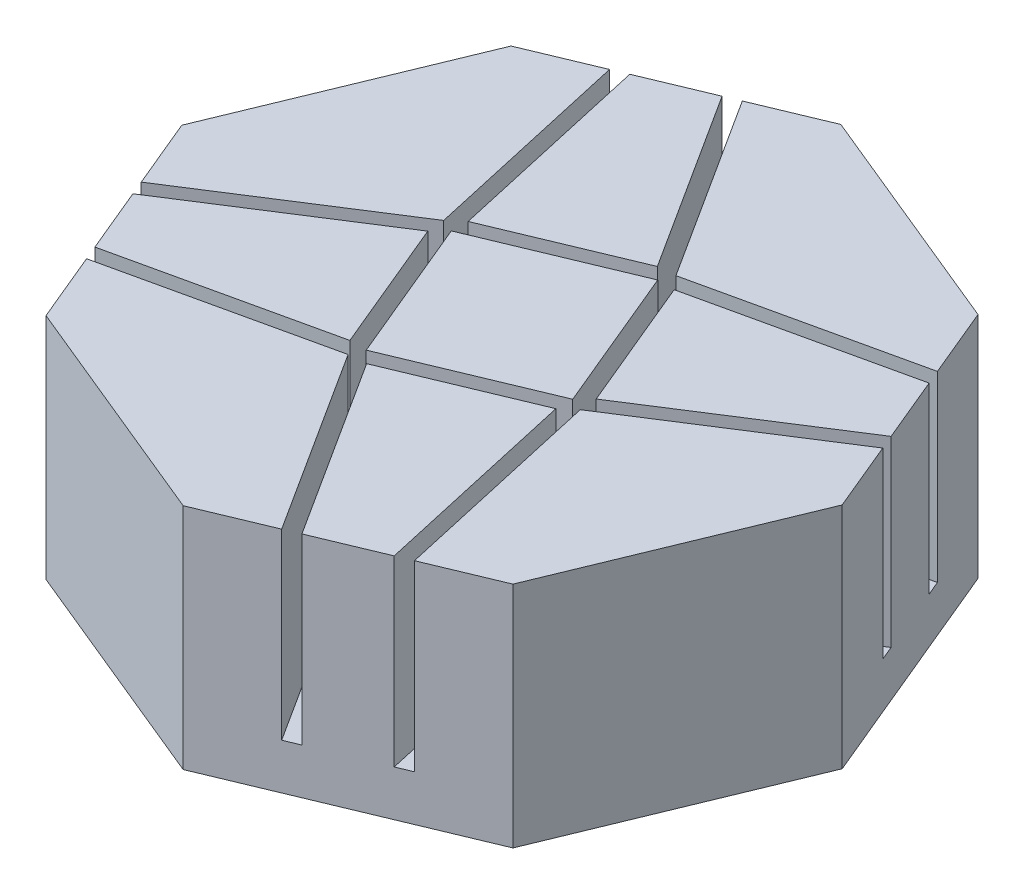
from build123d import *

# Parameters (mm, degrees)
BOSS_EXTRUDE1_DEPTH     = 38.1
CUT_EXTRUDE_THIN1_DEPTH = 30.48


with BuildPart() as part:
    # Sketch1 → Boss-Extrude1 (new body)
    with BuildSketch(Plane(origin=(0, 0, 0), x_dir=(1, 0, 0), z_dir=(0, 1, 0))):
        Polygon((-0.111992667, 54.937923296), (-38.926168882, 38.767787333), (-54.937923296, -0.111992667), (-38.767787333, -38.926168882), (0.111992667, -54.937923296), (38.926168882, -38.767787333), (54.937923296, 0.111992667), (38.767787333, 38.926168882), align=None)
    extrude(amount=BOSS_EXTRUDE1_DEPTH)

    # Sketch2 → Cut-Extrude-Thin1 (cut)
    with BuildSketch(Plane(origin=(0, 38.1, 0), x_dir=(1, 0, 0), z_dir=(0, 1, 0))):
        Polygon((24.950943415, -44.589920325), (17.176445042, -9.856652985), (-5.097897691, -19.136230336), (14.087218134, -49.115790304), (11.947790374, -50.484895435), (-8.86896141, -17.955664748), (18.993913528, -6.347883261), (27.429609427, -44.035109726), align=None)
        Polygon((-44.589920325, -24.950943415), (-9.856652985, -17.176445042), (-19.136230336, 5.097897691), (-49.115790304, -14.087218134), (-50.484895435, -11.947790374), (-17.955664748, 8.86896141), (-6.347883261, -18.993913528), (-44.035109726, -27.429609427), align=None)
        Polygon((-24.950943415, 44.589920325), (-17.176445042, 9.856652985), (5.097897691, 19.136230336), (-14.087218134, 49.115790304), (-11.947790374, 50.484895435), (8.86896141, 17.955664748), (-18.993913528, 6.347883261), (-27.429609427, 44.035109726), align=None)
        Polygon((44.589920325, 24.950943415), (9.856652985, 17.176445042), (19.136230336, -5.097897691), (49.115790304, 14.087218134), (50.484895435, 11.947790374), (17.955664748, -8.86896141), (6.347883261, 18.993913528), (44.035109726, 27.429609427), align=None)
    extrude(amount=-CUT_EXTRUDE_THIN1_DEPTH, mode=Mode.SUBTRACT)


solid = part.part
